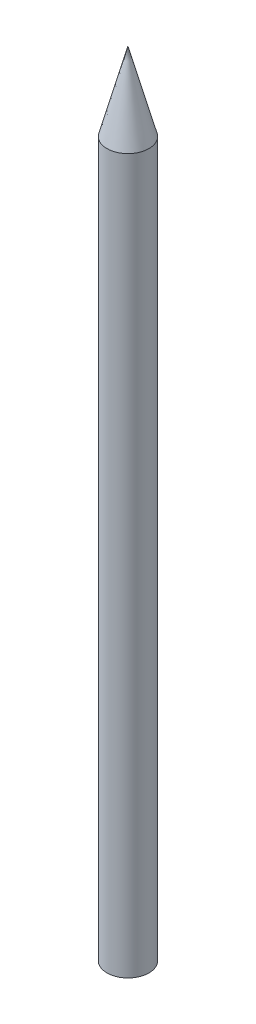
from build123d import *


with BuildPart() as part:
    # Sketch1 → Revolve1 (revolve)
    with BuildSketch(Plane(origin=(0, 0, 0), x_dir=(0, 0, -1), z_dir=(1, 0, 0))):
        Polygon((0, 0), (0, -10), (0.265, -10), (0.265, -0.988993464), align=None)
    revolve(axis=Axis((0, 0, 0), (0, -1, 0)))


solid = part.part
